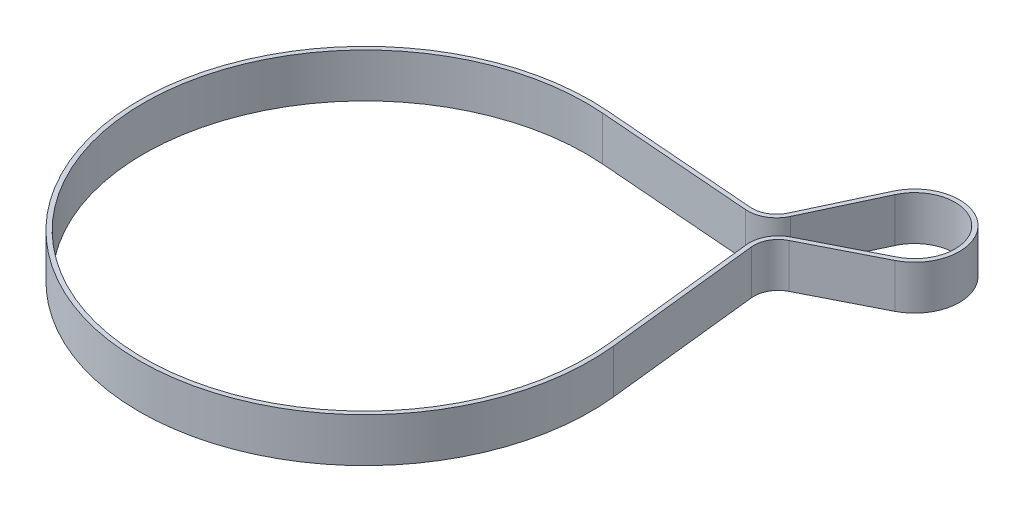
from build123d import *

# Parameters (mm, degrees)
BOSS_EXTRUDE1_DEPTH = 10


with BuildPart() as part:
    # Sketch1 → Boss-Extrude1 (new body)
    with BuildSketch(Plane(origin=(0, 0, 0), x_dir=(1, 0, 0), z_dir=(0, 1, 0))):
        with BuildLine():
            Line((-3.197802304, 60.450073138), (-10.78557004, 44.267462694))
            ThreePointArc((-10.78557004, 44.267462694), (-12.997646781, 41.849514237), (-16.192346026, 41.118997306))
            Line((-16.192346026, 41.118997306), (-51.345713088, 43.856493285))
            ThreePointArc((-51.345713088, 43.856493285), (-90.906449046, -43.828164288), (-4.486759028, -1.575493597))
            Line((-4.486759028, -1.575493597), (-8.309742442, 33.476437845))
            ThreePointArc((-8.309742442, 33.476437845), (-7.678341525, 36.692194542), (-5.329937086, 38.977966806))
            Line((-5.329937086, 38.977966806), (10.610355689, 47.062406568))
            ThreePointArc((10.610355689, 47.062406568), (13.089481768, 63.434160758), (-3.197802304, 60.450073138))
        make_face()
        with BuildLine():
            ThreePointArc((-5.480863845, -1.683916901), (-90.210358478, -43.110210305), (-51.423350976, 42.859511662))
            Line((-51.423350976, 42.859511662), (-16.269983915, 40.122015682))
            ThreePointArc((-16.269983915, 40.122015682), (-12.494430262, 40.985353873), (-9.880157749, 43.842929323))
            Line((-9.880157749, 43.842929323), (-2.292390013, 60.025539767))
            ThreePointArc((-2.292390013, 60.025539767), (12.393391201, 62.716206775), (10.158033664, 47.954261256))
            Line((10.158033664, 47.954261256), (-5.782259111, 39.869821495))
            ThreePointArc((-5.782259111, 39.869821495), (-8.557646175, 37.168454274), (-9.303847259, 33.368014541))
            Line((-9.303847259, 33.368014541), (-5.480863845, -1.683916901))
        make_face(mode=Mode.SUBTRACT)
    extrude(amount=BOSS_EXTRUDE1_DEPTH)


solid = part.part
